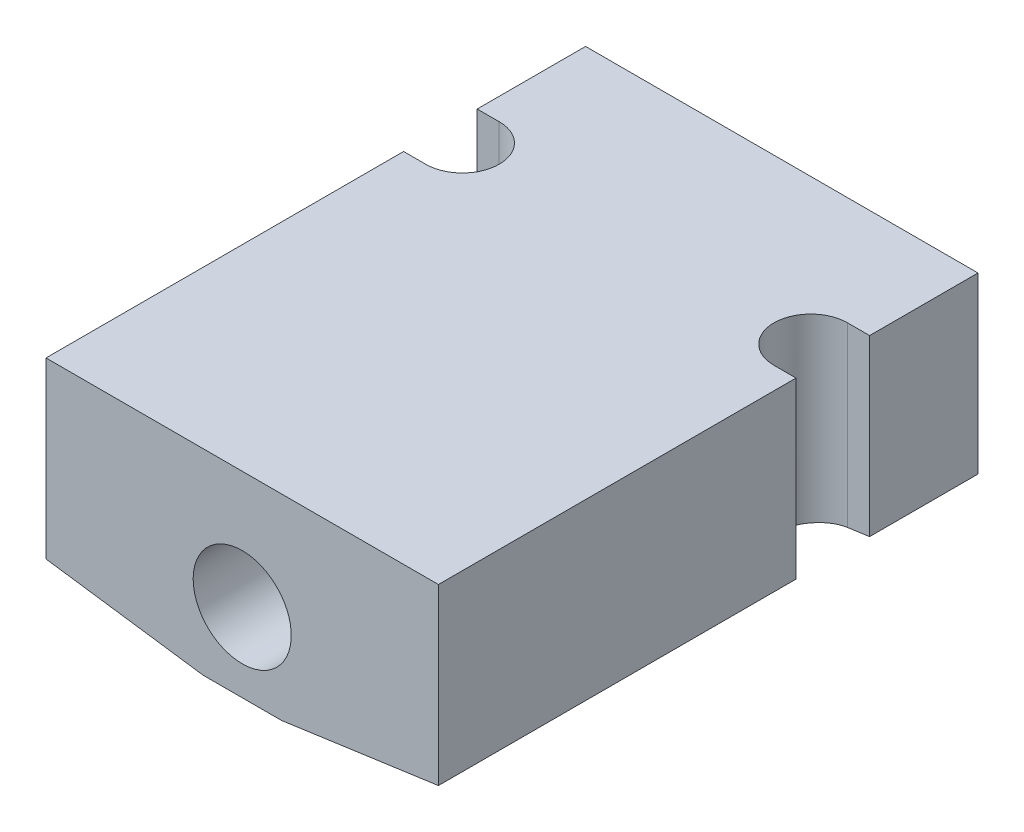
from build123d import *

# Parameters (mm, degrees)
SKETCH1_W                   = 25.4
SKETCH1_H                   = 12.7
EXTRUDE1_DEPTH              = 34.925
CHAMFER1_SIZE               = 10.16
CHAMFER1_SIZE2              = 1.427894881
F_1_4_0_25_DIAMETER_HOLE1_D = 6.35
EXTRUDE2_DEPTH              = 40.272581084


with BuildPart() as part:
    # Sketch1 → Extrude1 (new body)
    with BuildSketch(Plane.XY):
        Rectangle(SKETCH1_W, SKETCH1_H)
    extrude(amount=EXTRUDE1_DEPTH)

    # Chamfer1
    chamfer1_edges = [part.edges().sort_by_distance(p)[0] for p in [
        (12.7, -6.35, 17.4625),
        (-12.7, -6.35, 17.4625),
    ]]
    chamfer1_side = [part.faces().sort_by_distance(p)[0] for p in [
        (0, -6.35, 17.4625),
    ]]
    chamfer(chamfer1_edges, length=CHAMFER1_SIZE, length2=CHAMFER1_SIZE2, reference=chamfer1_side[0])

    # 1/4 (0.25) Diameter Hole1 (through all)
    with Locations(Plane(origin=(0, 0, 0), x_dir=(-1, 0, 0), z_dir=(0, 0, -1))):
        with Locations((0, -1.27)):
            Hole(F_1_4_0_25_DIAMETER_HOLE1_D / 2)

    # Sketch5 → Extrude2 (cut, through all)
    with BuildSketch(Plane(origin=(0, 6.35, 0), x_dir=(1, 0, 0), z_dir=(0, 1, 0))):
        with BuildLine():
            Line((-11.27125, -11.77925), (-12.7, -11.77925))
            Line((-12.7, -11.77925), (-12.7, -7.01675))
            Line((-12.7, -7.01675), (-11.27125, -7.01675))
            ThreePointArc((-11.27125, -7.01675), (-8.89, -9.398), (-11.27125, -11.77925))
        make_face()
    extrude2 = extrude(amount=-EXTRUDE2_DEPTH, mode=Mode.SUBTRACT)

    # Mirror1: Extrude2 across plane
    add(extrude2.mirror(Plane(origin=(0, 0, 0), x_dir=(0, 0, 1), z_dir=(1, 0, 0))), mode=Mode.SUBTRACT)


solid = part.part
